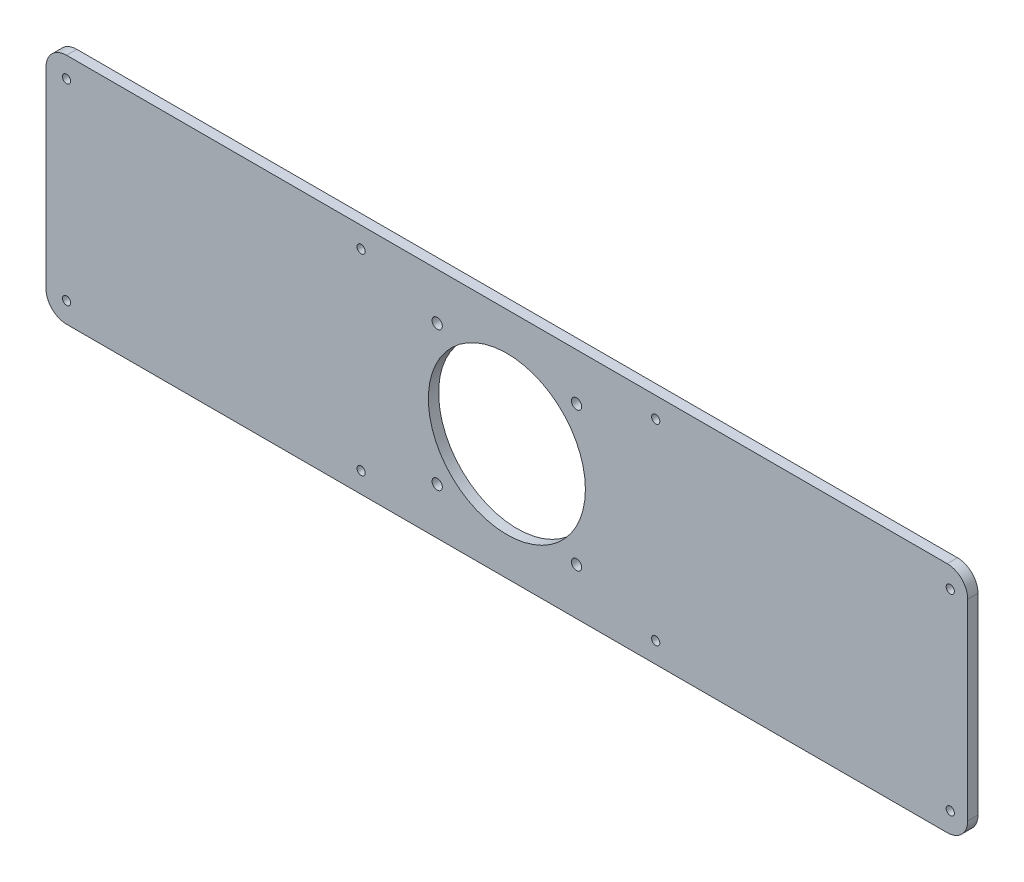
from build123d import *

# Parameters (mm, degrees)
ESQUISSE1_W        = 449
ESQUISSE1_H        = 113.5
ESQUISSE1_R        = 2
ESQUISSE1_R_2      = 38.25
ESQUISSE1_R_3      = 2.5
BOSS_EXTRU_1_DEPTH = 5
CONG_1_R           = 10


with BuildPart() as part:
    # Esquisse1 → Boss.-Extru.1 (new body)
    with BuildSketch(Plane.XY):
        with Locations((224.5, 56.75)):
            Rectangle(ESQUISSE1_W, ESQUISSE1_H)
        with Locations((10, 10)):
            Circle(ESQUISSE1_R, mode=Mode.SUBTRACT)
        with Locations((153.5, 10)):
            Circle(ESQUISSE1_R, mode=Mode.SUBTRACT)
        with Locations((297, 10)):
            Circle(ESQUISSE1_R, mode=Mode.SUBTRACT)
        with Locations((440.5, 10)):
            Circle(ESQUISSE1_R, mode=Mode.SUBTRACT)
        with Locations((153.5, 103.5)):
            Circle(ESQUISSE1_R, mode=Mode.SUBTRACT)
        with Locations((297, 103.5)):
            Circle(ESQUISSE1_R, mode=Mode.SUBTRACT)
        with Locations((440.5, 103.5)):
            Circle(ESQUISSE1_R, mode=Mode.SUBTRACT)
        with Locations((10, 103.5)):
            Circle(ESQUISSE1_R, mode=Mode.SUBTRACT)
        with Locations((224.5, 56.75)):
            Circle(ESQUISSE1_R_2, mode=Mode.SUBTRACT)
        with Locations((258.441125497, 90.691125497)):
            Circle(ESQUISSE1_R_3, mode=Mode.SUBTRACT)
        with Locations((258.441125497, 22.808874503)):
            Circle(ESQUISSE1_R_3, mode=Mode.SUBTRACT)
        with Locations((190.558874503, 22.808874503)):
            Circle(ESQUISSE1_R_3, mode=Mode.SUBTRACT)
        with Locations((190.558874503, 90.691125497)):
            Circle(ESQUISSE1_R_3, mode=Mode.SUBTRACT)
    extrude(amount=BOSS_EXTRU_1_DEPTH)

    # Congé1
    cong_1_edges = [part.edges().sort_by_distance(p)[0] for p in [
        (0, 113.5, 2.5),
        (449, 113.5, 2.5),
        (449, 0, 2.5),
        (0, 0, 2.5),
    ]]
    fillet(cong_1_edges, radius=CONG_1_R)


solid = part.part
